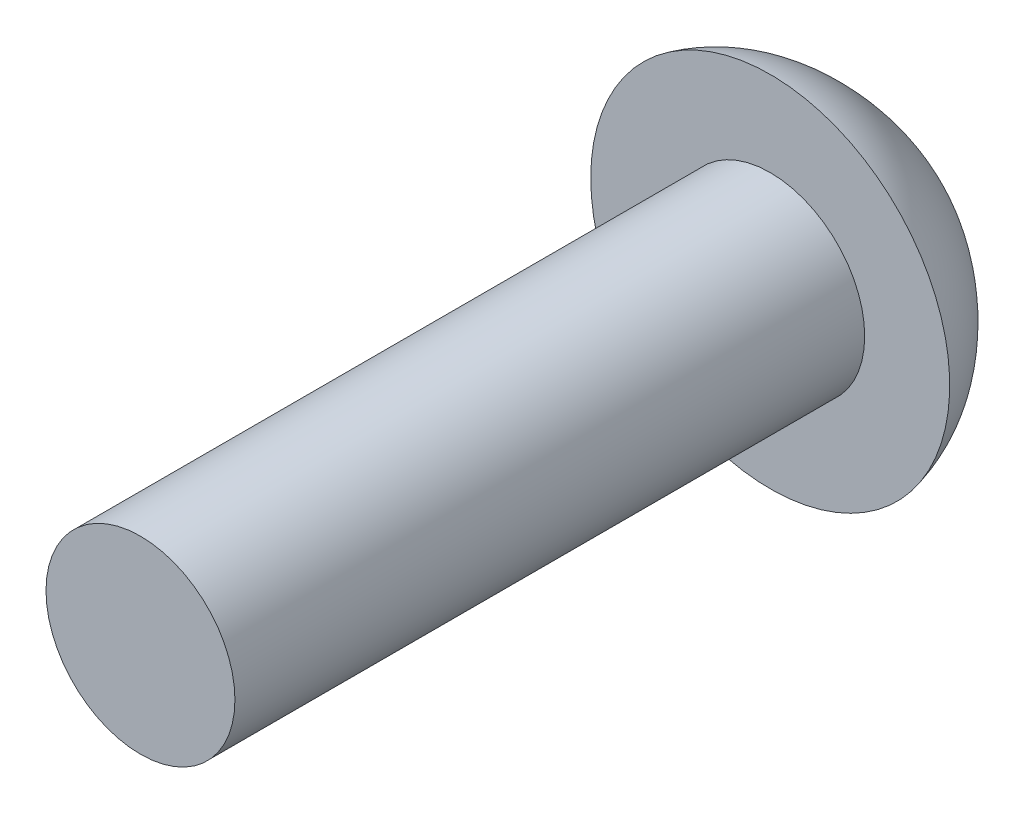
from build123d import *

# Parameters (mm, degrees)
CUT_EXTRUDE1_DEPTH = 1.5


with BuildPart() as part:
    # Sketch1 → Revolve1 (revolve)
    with BuildSketch(Plane(origin=(0, 0, 0), x_dir=(1, 0, 0), z_dir=(0, 1, 0)), mode=Mode.PRIVATE) as revolve1_sk:
        with BuildLine():
            Line((1.5, 0), (1.5, 10))
            Line((1.5, 10), (2.85, 10))
            add(Edge.make_bspline(
                [(1.5, 11.65), (2.631595647, 10.927172538), (2.85, 10)],
                knots=[0, 0, 0, 0.488855094, 0.488855094, 0.488855094], degree=2))
            Line((1.5, 11.65), (0, 11.65))
            Line((0, 11.65), (0, 0))
            Line((0, 0), (1.5, 0))
        make_face()
    revolve(revolve1_sk.sketch.rotate(Axis((0, 0, -11.65), (0, 0, 1)), 180), axis=Axis((0, 0, -11.65), (0, 0, 1)))

    # Sketch2 → Cut-Extrude1 (cut)
    with BuildSketch(Plane(origin=(0, 0, -11.65), x_dir=(-1, 0, 0), z_dir=(0, 0, -1))):
        Polygon((0.576895528, 1.000262407), (-0.577804891, 0.999737386), (-1.154700419, -0.000525021), (-0.576895528, -1.000262407), (0.577804891, -0.999737386), (1.154700419, 0.000525021), align=None)
    extrude(amount=-CUT_EXTRUDE1_DEPTH, mode=Mode.SUBTRACT)


solid = part.part
